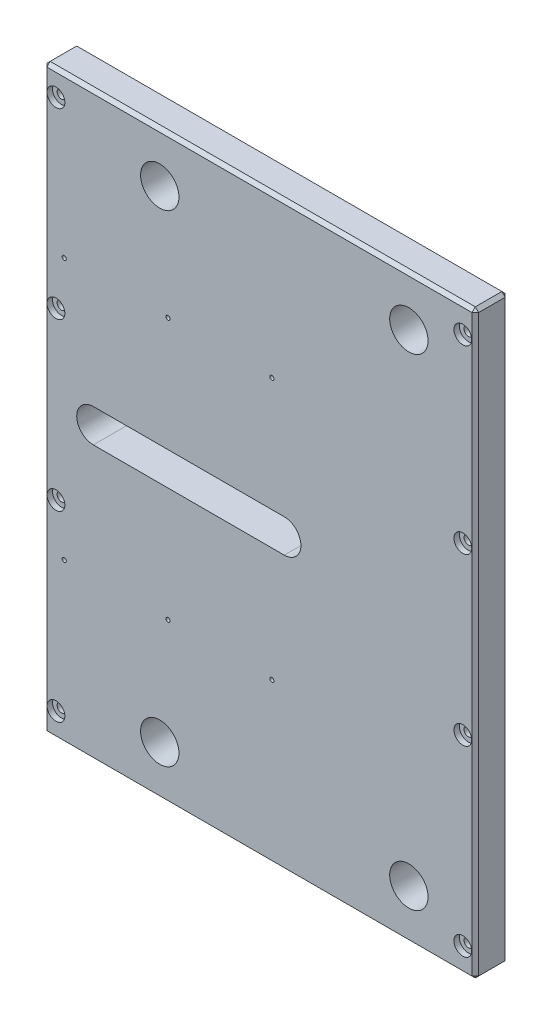
from build123d import *

# Parameters (mm, degrees)
SKETCH_1_W                    = 520
SKETCH_1_H                    = 700
EXTRUDE_1_DEPTH               = 40
SKETCH_2_R                    = 23.1
CUT_EXTRUDE_1_DEPTH           = 873.926113712
CHAMFER_1_SIZE                = 4
M6X1_0_1_D                    = 5
CUT_EXTRUDE_2_DEPTH           = 873.926113712
HOLE_WIZARD_M10_1_D           = 10.5
HOLE_WIZARD_M10_1_CBORE_D     = 21.48
HOLE_WIZARD_M10_1_CBORE_DEPTH = 6.63
HOLE_WIZARD_M6_1_D            = 5
HOLE_WIZARD_M6_1_DEPTH        = 15
HOLE_WIZARD_M6_1_TIP          = 1.502151548


with BuildPart() as part:
    # 草图1 → 凸台-拉伸1 (new body)
    with BuildSketch(Plane.XY):
        with Locations((260, 350)):
            Rectangle(SKETCH_1_W, SKETCH_1_H)
    extrude(amount=EXTRUDE_1_DEPTH)

    # 草图2 → 切除-拉伸1 (cut, through all)
    with BuildSketch(Plane.XY.offset(40)):
        with Locations((140, 60)):
            Circle(SKETCH_2_R)
        with Locations((440, 60)):
            Circle(SKETCH_2_R)
        with Locations((440, 640)):
            Circle(SKETCH_2_R)
        with Locations((140, 640)):
            Circle(SKETCH_2_R)
    extrude(amount=-CUT_EXTRUDE_1_DEPTH, mode=Mode.SUBTRACT)

    # 倒角1
    chamfer_1_edges = [part.edges().sort_by_distance(p)[0] for p in [
        (0, 350, 40),
        (0, 350, 0),
        (260, 700, 40),
        (0, 700, 20),
        (260, 700, 0),
        (520, 350, 40),
        (520, 700, 20),
        (520, 350, 0),
        (0, 0, 20),
        (260, 0, 40),
        (520, 0, 20),
        (260, 0, 0),
    ]]
    chamfer(chamfer_1_edges, length=CHAMFER_1_SIZE)

    # M6x1.0 螺纹孔1 (through all)
    with Locations(Plane.XY.offset(40)):
        with Locations((25, 507.5), (150, 507.5), (275, 507.5), (275, 192.5), (150, 192.5), (25, 192.5)):
            Hole(M6X1_0_1_D / 2)

    # 草图5 → 切除-拉伸2 (cut, through all)
    with BuildSketch(Plane.XY.offset(40)):
        with BuildLine():
            Line((60, 370), (290, 370))
            ThreePointArc((290, 370), (310, 350), (290, 330))
            Line((290, 330), (60, 330))
            ThreePointArc((60, 330), (40, 350), (60, 370))
        make_face()
    extrude(amount=-CUT_EXTRUDE_2_DEPTH, mode=Mode.SUBTRACT)

    # M10 六角头螺钉的柱形沉头孔1 (through all)
    with Locations(Plane.XY.offset(40)):
        with Locations((15, 670), (15, 450), (15, 250), (15, 30), (505, 30), (505, 250), (505, 450), (505, 667.622862113)):
            CounterBoreHole(HOLE_WIZARD_M10_1_D / 2, HOLE_WIZARD_M10_1_CBORE_D / 2, HOLE_WIZARD_M10_1_CBORE_DEPTH)

    # M6 螺纹孔1
    with Locations(Plane(origin=(0, 0, 0), x_dir=(-1, 0, 0), z_dir=(0, -1, 0))):
        with Locations((-260, -20)):
            Hole(HOLE_WIZARD_M6_1_D / 2, depth=HOLE_WIZARD_M6_1_DEPTH)
            with Locations((0, 0, -(HOLE_WIZARD_M6_1_DEPTH + HOLE_WIZARD_M6_1_TIP / 2))):  # 118° drill point
                Cone(0, HOLE_WIZARD_M6_1_D / 2, HOLE_WIZARD_M6_1_TIP, mode=Mode.SUBTRACT)


solid = part.part
